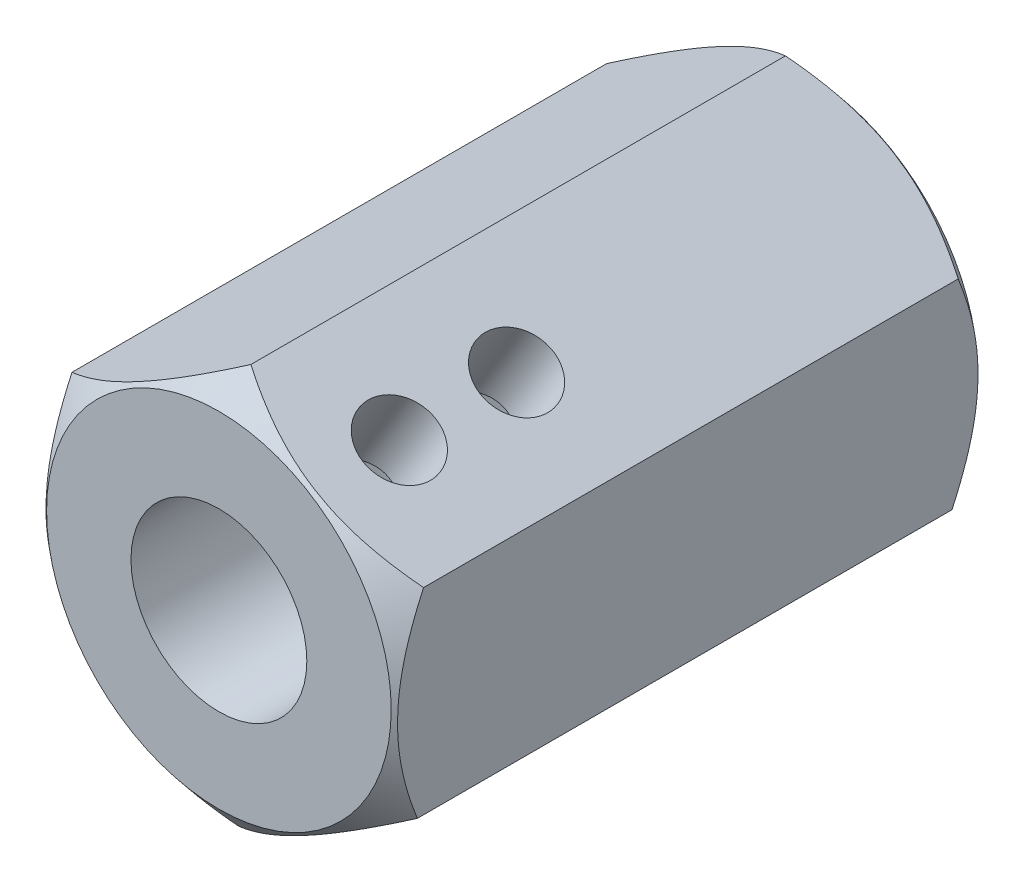
from build123d import *

# Parameters (mm, degrees)
BOSS_EXTRUDE1_DEPTH     = 20
SKETCH2_R               = 2
CUT_EXTRUDE1_DEPTH      = 20
SKETCH3_R               = 3
CUT_EXTRUDE2_DEPTH      = 13.5
SKETCH4_OUTSIDE_W       = 74.532
SKETCH4_OUTSIDE_H       = 76.178
SKETCH4_OUTSIDE_R       = 5.878507538
CUT_EXTRUDE3_DEPTH      = 23.027138831
CUT_EXTRUDE3_DRAFT      = -50
MIRROR1_COPY_1_SKETCH_W = 74.532
MIRROR1_COPY_1_SKETCH_H = 76.178
MIRROR1_COPY_1_SKETCH_R = 5.878507538
MIRROR1_COPY_1_DEPTH    = 23.027138831
MIRROR1_COPY_1_DRAFT    = -50
CUT_EXTRUDE4_REACH      = 27.108
CUT_EXTRUDE4_END_RADIUS = 3
SKETCH5_R               = 1.25


with BuildPart() as part:
    # Sketch1 → Boss-Extrude1 (new body)
    with BuildSketch(Plane.XY):
        Polygon((-6.102382196, -3.280385881), (-0.210293591, -6.925010946), (5.892088606, -3.644625065), (6.102382196, 3.280385881), (0.210293591, 6.925010946), (-5.892088606, 3.644625065), align=None)
    extrude(amount=BOSS_EXTRUDE1_DEPTH)

    # Sketch2 → Cut-Extrude1 (cut)
    with BuildSketch(Plane(origin=(0, 0, 0), x_dir=(-1, 0, 0), z_dir=(0, 0, -1))):
        Circle(SKETCH2_R)
    extrude(amount=-CUT_EXTRUDE1_DEPTH, mode=Mode.SUBTRACT)

    # Sketch3 → Cut-Extrude2 (cut)
    with BuildSketch(Plane.XY.offset(20)):
        Circle(SKETCH3_R)
    extrude(amount=-CUT_EXTRUDE2_DEPTH, mode=Mode.SUBTRACT)


with BuildPart() as cut_extrude3_tool:
    # Sketch4 outside → Cut-Extrude3 (with draft: the straight prism first)
    with BuildSketch(Plane.XY.offset(20)):
        Rectangle(SKETCH4_OUTSIDE_W, SKETCH4_OUTSIDE_H)
        Circle(SKETCH4_OUTSIDE_R, mode=Mode.SUBTRACT)
    extrude(amount=-CUT_EXTRUDE3_DEPTH)
    # Cut-Extrude3: the draft: its side faces are tilted about the plane it starts from
    cut_extrude3_sides = [cut_extrude3_tool.faces().sort_by_distance(p)[0] for p in [
        (0, -38.089, 8.486430585),
        (37.266, 0, 8.486430585),
        (0, 38.089, 8.486430585),
        (-37.266, 0, 8.486430585),
        (-5.878507538, 0, 8.486430585),
    ]]
    draft(cut_extrude3_sides, Plane.XY.offset(20), CUT_EXTRUDE3_DRAFT)


with BuildPart() as part_1:
    add(part.part)

    # Cut-Extrude3: cut by cut_extrude3_tool
    add(cut_extrude3_tool.part, mode=Mode.SUBTRACT)


with BuildPart() as mirror1_copy_1_tool:
    # Mirror1 copy 1 sketch → Mirror1 copy 1 (with draft: the straight prism first)
    with BuildSketch(Plane(origin=(0, 0, 0), x_dir=(1, 0, 0), z_dir=(0, 0, -1))):
        Rectangle(MIRROR1_COPY_1_SKETCH_W, MIRROR1_COPY_1_SKETCH_H)
        Circle(MIRROR1_COPY_1_SKETCH_R, mode=Mode.SUBTRACT)
    extrude(amount=-MIRROR1_COPY_1_DEPTH)
    # Mirror1 copy 1: the draft: its side faces are tilted about the plane it starts from
    mirror1_copy_1_sides = [mirror1_copy_1_tool.faces().sort_by_distance(p)[0] for p in [
        (0, -38.089, 11.513569415),
        (37.266, 0, 11.513569415),
        (0, 38.089, 11.513569415),
        (-37.266, 0, 11.513569415),
        (-5.878507538, 0, 11.513569415),
    ]]
    draft(mirror1_copy_1_sides, Plane(origin=(0, 0, 0), x_dir=(1, 0, 0), z_dir=(0, 0, -1)), MIRROR1_COPY_1_DRAFT)


with BuildPart() as part_2:
    add(part_1.part)

    # Mirror1 copy 1: cut by mirror1_copy_1_tool
    add(mirror1_copy_1_tool.part, mode=Mode.SUBTRACT)

    # Cut-Extrude4: up to this cylinder (the profile starts outside it)
    cut_extrude4_end = Plane(origin=(0, 0, 15), z_dir=(0, 0, 1)) * Cylinder(CUT_EXTRUDE4_END_RADIUS, 65.216, mode=Mode.PRIVATE)
    # Sketch5 → Cut-Extrude4 (cut, up to the surface)
    with BuildSketch(Plane(origin=(3.156337894, 5.102698414, 0), x_dir=(0.8504497356266733, -0.5260563155903765, 0), z_dir=(0.5260563155903764, 0.8504497356266731, 0)), mode=Mode.PRIVATE) as cut_extrude4_sk1:
        with Locations(Location((0, -17, 0), (0, 0, 180))):
            Circle(SKETCH5_R)
    cut_extrude4_tool1 = extrude(cut_extrude4_sk1.sketch, amount=-CUT_EXTRUDE4_REACH, mode=Mode.PRIVATE) - cut_extrude4_end
    add(cut_extrude4_tool1.solids().sort_by_distance((3.156338, 5.102698, 17))[0], mode=Mode.SUBTRACT)
    # Sketch5 → Cut-Extrude4 (cut, up to the surface)
    with BuildSketch(Plane(origin=(3.156337894, 5.102698414, 0), x_dir=(0.8504497356266733, -0.5260563155903765, 0), z_dir=(0.5260563155903764, 0.8504497356266731, 0)), mode=Mode.PRIVATE) as cut_extrude4_sk2:
        with Locations(Location((0, -13, 0), (0, 0, 180))):
            Circle(SKETCH5_R)
    cut_extrude4_tool2 = extrude(cut_extrude4_sk2.sketch, amount=-CUT_EXTRUDE4_REACH, mode=Mode.PRIVATE) - cut_extrude4_end
    add(cut_extrude4_tool2.solids().sort_by_distance((3.156338, 5.102698, 13))[0], mode=Mode.SUBTRACT)


solid = part_2.part
